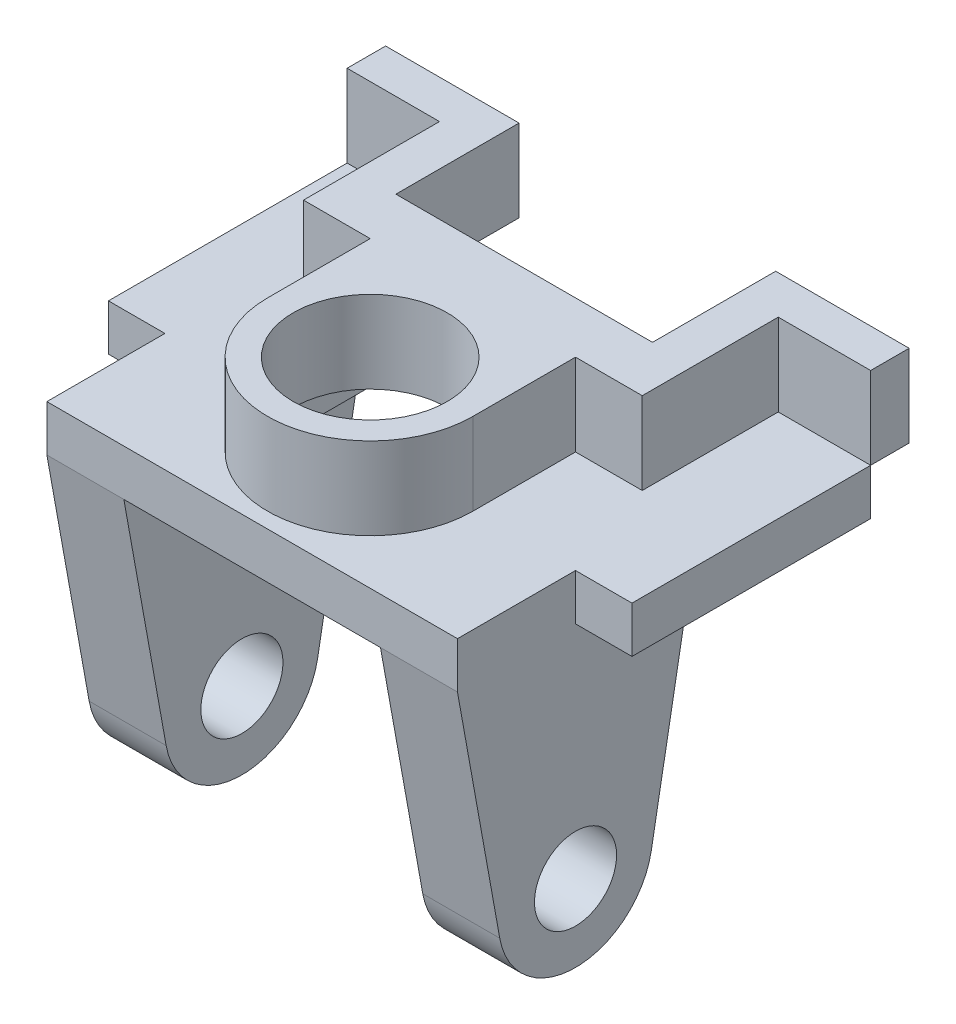
from build123d import *

# Parameters (mm, degrees)
SKETCH1_R           = 30
BOSS_EXTRUDE1_DEPTH = 32
BOSS_EXTRUDE2_DEPTH = 18
SKETCH2_R           = 16
BOSS_EXTRUDE3_DEPTH = 30


with BuildPart() as part:
    # Sketch1 → Boss-Extrude1 (new body)
    with BuildSketch(Plane(origin=(0, 0, 0), x_dir=(1, 0, 0), z_dir=(0, 1, 0))):
        with BuildLine():
            ThreePointArc((-40, 0), (0, -40), (40, 0))
            Line((40, 0), (40, 40))
            Line((40, 40), (66, 40))
            Line((66, 40), (66, 93))
            Line((66, 93), (102, 93))
            Line((102, 93), (102, 108))
            Line((102, 108), (50, 108))
            Line((50, 108), (50, 60))
            Line((50, 60), (-50, 60))
            Line((-50, 60), (-50, 108))
            Line((-50, 108), (-102, 108))
            Line((-102, 108), (-102, 93))
            Line((-102, 93), (-66, 93))
            Line((-66, 93), (-66, 40))
            Line((-66, 40), (-40, 40))
            Line((-40, 40), (-40, 0))
        make_face()
        Circle(SKETCH1_R, mode=Mode.SUBTRACT)
    extrude(amount=BOSS_EXTRUDE1_DEPTH)


with BuildPart() as body_2:
    # Sketch1<3> → Boss-Extrude2 (new body)
    with BuildSketch(Plane(origin=(0, 0, 0), x_dir=(1, 0, 0), z_dir=(0, 1, 0))):
        with BuildLine():
            Line((40, 40), (40, 0))
            ThreePointArc((40, 0), (0, -40), (-40, 0))
            Line((-40, 0), (-40, 40))
            Line((-40, 40), (-66, 40))
            Line((-66, 40), (-66, 93))
            Line((-66, 93), (-102, 93))
            Line((-102, 93), (-102, 0))
            Line((-102, 0), (-80, 0))
            Line((-80, 0), (-80, -46))
            Line((-80, -46), (80, -46))
            Line((80, -46), (80, 0))
            Line((80, 0), (102, 0))
            Line((102, 0), (102, 93))
            Line((102, 93), (66, 93))
            Line((66, 93), (66, 40))
            Line((66, 40), (40, 40))
        make_face()
    extrude(amount=-BOSS_EXTRUDE2_DEPTH)

    # Sketch2 → Boss-Extrude3 (add)
    with BuildSketch(Plane(origin=(80, 0, 0), x_dir=(0, 0, -1), z_dir=(1, 0, 0))):
        with BuildLine():
            Line((-46, -18), (-29.523362503, -109.326449711))
            ThreePointArc((-29.523362503, -109.326449711), (0, -134), (29.523362503, -109.326449711))
            Line((29.523362503, -109.326449711), (46, -18))
            Line((46, -18), (-46, -18))
        make_face()
        with Locations((0, -104)):
            Circle(SKETCH2_R, mode=Mode.SUBTRACT)
    boss_extrude3 = extrude(amount=-BOSS_EXTRUDE3_DEPTH)

    # Mirror1: Boss-Extrude3 across plane
    add(boss_extrude3.mirror(Plane(origin=(0, 0, 0), x_dir=(0, 0, 1), z_dir=(1, 0, 0))))


solid = Compound([part.part, body_2.part])
